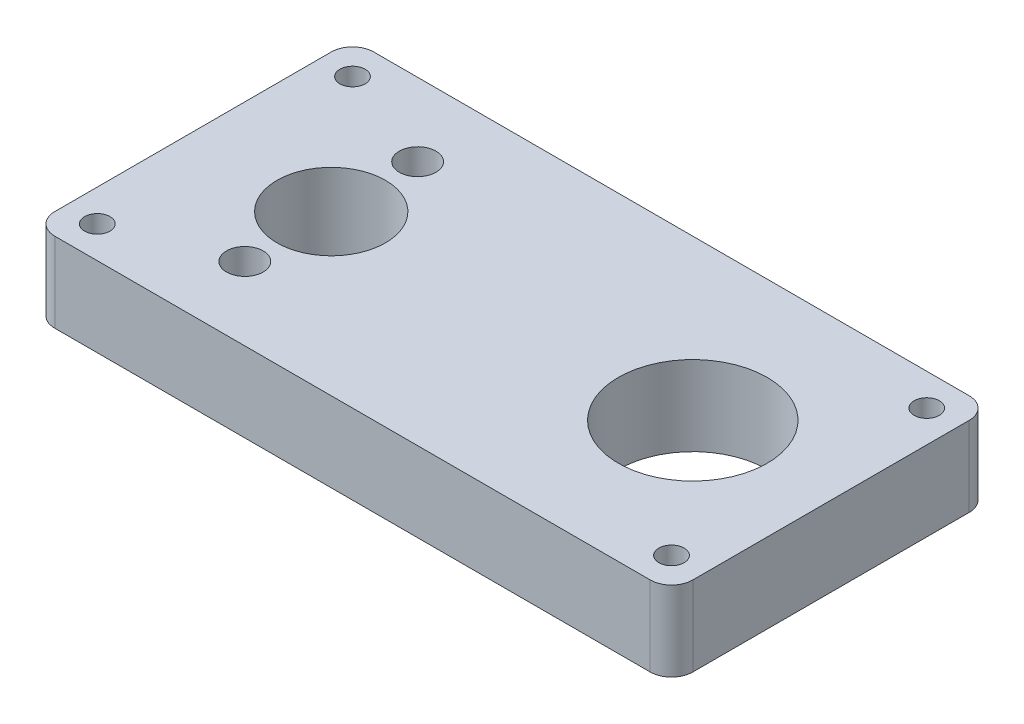
from build123d import *

# Parameters (mm, degrees)
SKETCH1_R                 = 6.477
SKETCH1_R_2               = 2.19075
SKETCH1_R_3               = 8.89
BOSS_EXTRUDE1_DEPTH       = 9.525
F_1_0MM_DOWEL_HOLE1_D     = 3.0226
F_1_0MM_DOWEL_HOLE1_DEPTH = 9.99998
F_1_0MM_DOWEL_HOLE1_TIP   = 0.908080654


with BuildPart() as part:
    # Sketch1 → Boss-Extrude1 (new body)
    with BuildSketch(Plane.XZ):
        with BuildLine():
            Line((-35.56, -19.05), (35.56, -19.05))
            ThreePointArc((35.56, -19.05), (37.356051224, -18.306051224), (38.1, -16.51))
            Line((38.1, -16.51), (38.1, 16.51))
            ThreePointArc((38.1, 16.51), (37.356051224, 18.306051224), (35.56, 19.05))
            Line((35.56, 19.05), (-35.56, 19.05))
            ThreePointArc((-35.56, 19.05), (-37.356051224, 18.306051224), (-38.1, 16.51))
            Line((-38.1, 16.51), (-38.1, -16.51))
            ThreePointArc((-38.1, -16.51), (-37.356051224, -18.306051224), (-35.56, -19.05))
        make_face()
        with Locations(Location((-21.59, 0, 0), (0, 0, 270))):
            Circle(SKETCH1_R, mode=Mode.SUBTRACT)
        with Locations(Location((-21.59, -10.31875, 0), (0, 0, 270))):
            Circle(SKETCH1_R_2, mode=Mode.SUBTRACT)
        with Locations(Location((-21.59, 10.31875, 0), (0, 0, 270))):
            Circle(SKETCH1_R_2, mode=Mode.SUBTRACT)
        with Locations(Location((21.59, 0, 0), (0, 0, 270))):
            Circle(SKETCH1_R_3, mode=Mode.SUBTRACT)
    extrude(amount=-BOSS_EXTRUDE1_DEPTH)

    # Ø1.0mm Dowel Hole1
    with Locations(Plane(origin=(0, 9.525, 0), x_dir=(1, 0, 0), z_dir=(0, 1, 0))):
        with Locations((-34.29, 15.24), (-34.29, -15.24), (34.29, -15.24), (34.29, 15.24)):
            Hole(F_1_0MM_DOWEL_HOLE1_D / 2, depth=F_1_0MM_DOWEL_HOLE1_DEPTH)
            with Locations((0, 0, -(F_1_0MM_DOWEL_HOLE1_DEPTH + F_1_0MM_DOWEL_HOLE1_TIP / 2))):  # 118° drill point
                Cone(0, F_1_0MM_DOWEL_HOLE1_D / 2, F_1_0MM_DOWEL_HOLE1_TIP, mode=Mode.SUBTRACT)


solid = part.part
